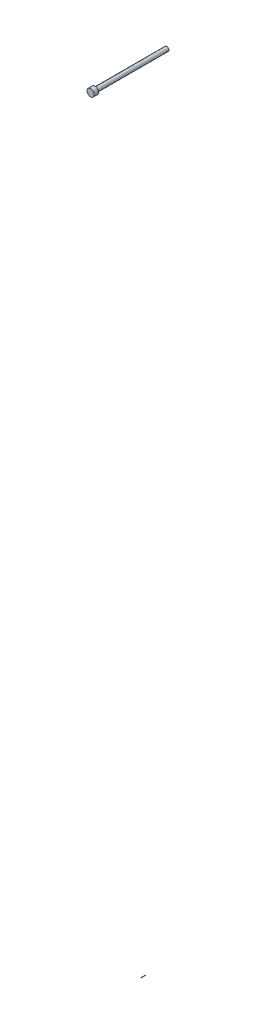
from build123d import *

# Parameters (mm, degrees)
SKETCH1_R             = 0.081171159
BOSS_EXTRUDE1_DEPTH   = 3
SKETCH1_R_2           = 2.5
BOSS_EXTRUDE1_2_DEPTH = 3
SKETCH2_R             = 1.5
BOSS_EXTRUDE2_DEPTH   = 50


with BuildPart() as part:
    # Sketch1 → Boss-Extrude1 (new body)
    with BuildSketch(Plane.XY):
        with Locations((35, 0)):
            Circle(SKETCH1_R)
    extrude(amount=BOSS_EXTRUDE1_DEPTH)


with BuildPart() as body_2:
    # Sketch1 → Boss-Extrude1 2 (new body)
    with BuildSketch(Plane.XY):
        with Locations((0, 515.93)):
            Circle(SKETCH1_R_2)
    extrude(amount=BOSS_EXTRUDE1_2_DEPTH)

    # Sketch2 → Boss-Extrude2 (add)
    with BuildSketch(Plane(origin=(0, 0, 0), x_dir=(-1, 0, 0), z_dir=(0, 0, -1))):
        with Locations((0, 515.93)):
            Circle(SKETCH2_R)
    extrude(amount=BOSS_EXTRUDE2_DEPTH)


solid = Compound([part.part, body_2.part])
